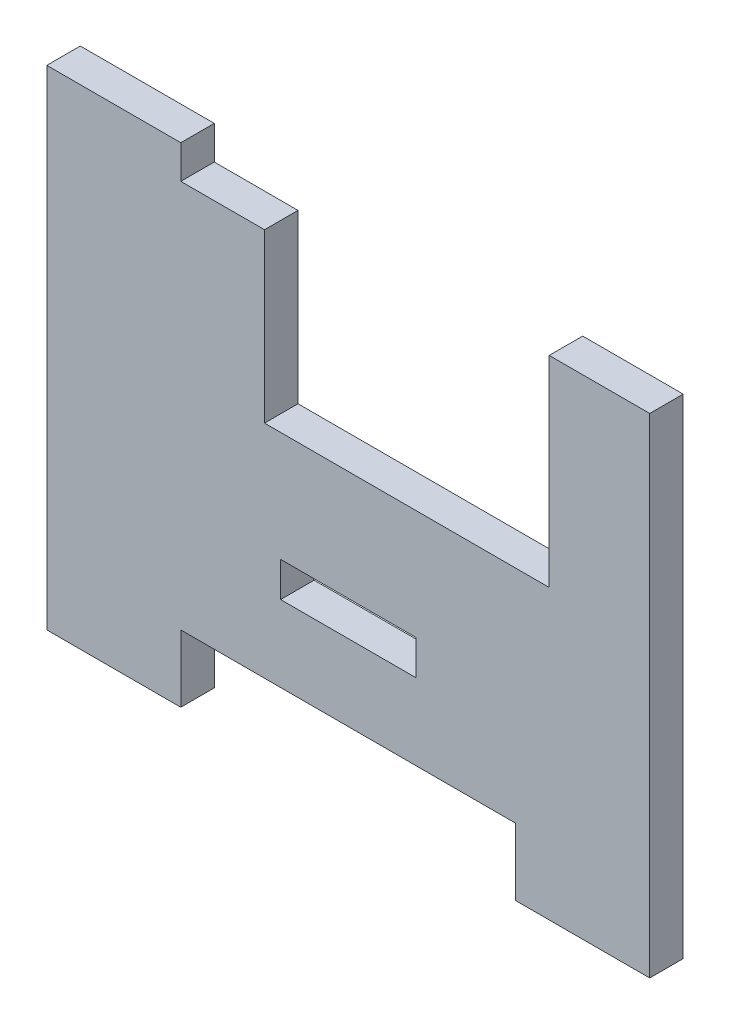
from build123d import *

# Parameters (mm, degrees)
SKETCH2_W           = 25.654
SKETCH2_H           = 6.604
BOSS_EXTRUDE1_DEPTH = 6.35


with BuildPart() as part:
    # Sketch2 → Boss-Extrude1 (new body)
    with BuildSketch(Plane(origin=(0, 0, 0), x_dir=(1, 0, 0), z_dir=(0, 0, -1))):
        Polygon((-82.55, 73.64), (-82.55, 0), (-82.55, -6.35), (-101.6, -6.35), (-101.6, 0), (-101.6, 31.75), (-155.575, 31.75), (-155.575, 0), (-171.45, 0), (-171.45, -6.35), (-196.85, -6.35), (-196.85, 0), (-196.85, 73.64), (-196.85, 86.34), (-171.45, 86.34), (-171.45, 73.64), (-107.95, 73.64), (-107.95, 86.34), (-82.55, 86.34), align=None)
        with Locations((-139.7, 55.895)):
            Rectangle(SKETCH2_W, SKETCH2_H, mode=Mode.SUBTRACT)
    extrude(amount=BOSS_EXTRUDE1_DEPTH)


solid = part.part
